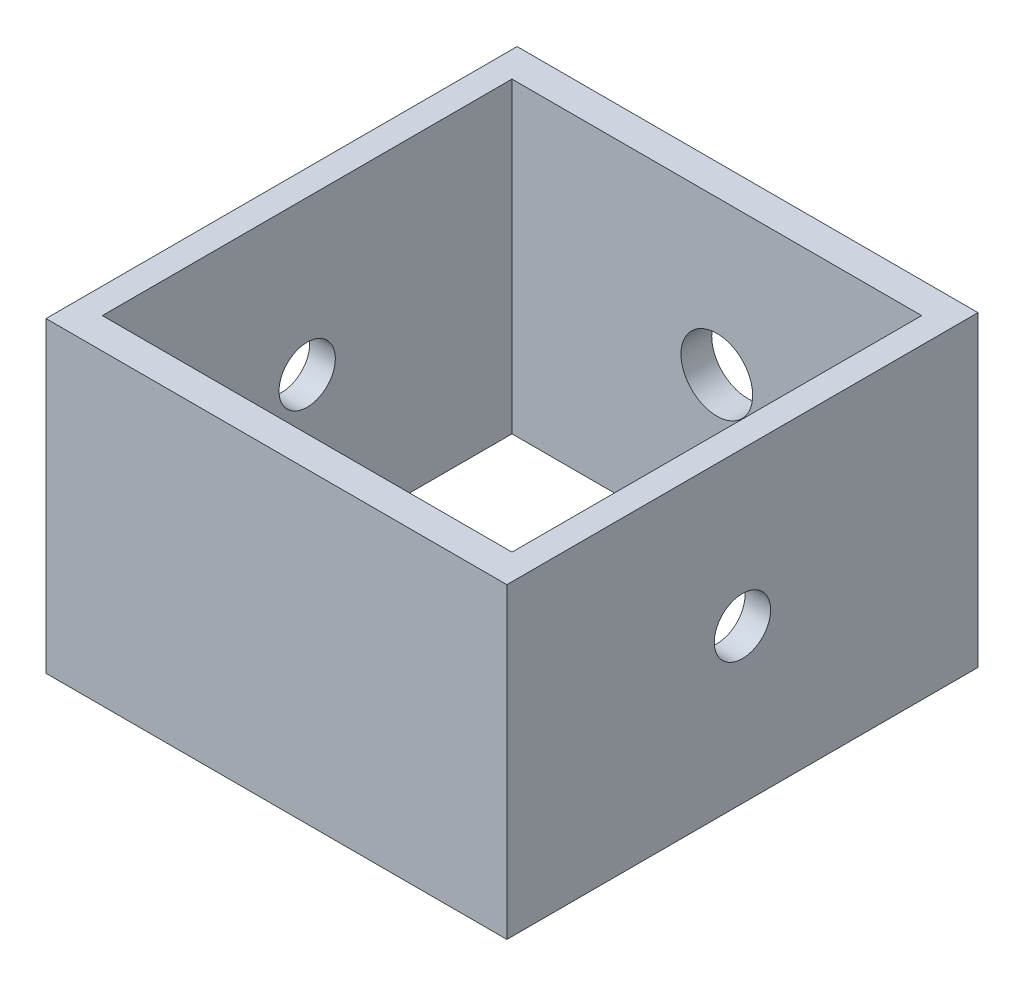
from build123d import *

# Parameters (mm, degrees)
SKETCH1_W           = 45
SKETCH1_H           = 46
BOSS_EXTRUDE1_DEPTH = 30
SKETCH3_R           = 3.5
CUT_EXTRUDE2_DEPTH  = 10
SKETCH4_R           = 2.75
CUT_EXTRUDE3_DEPTH  = 59.77074102
SKETCH2_W           = 40
SKETCH2_H           = 40
CUT_EXTRUDE4_DEPTH  = 44.991476447


with BuildPart() as part:
    # Sketch1 → Boss-Extrude1 (new body)
    with BuildSketch(Plane(origin=(0, 0, 0), x_dir=(1, 0, 0), z_dir=(0, 1, 0))):
        Rectangle(SKETCH1_W, SKETCH1_H)
    extrude(amount=BOSS_EXTRUDE1_DEPTH)

    # Sketch3 → Cut-Extrude2 (cut)
    with BuildSketch(Plane(origin=(0, 0, -23), x_dir=(-1, 0, 0), z_dir=(0, 0, -1))):
        with Locations((0, 15)):
            Circle(SKETCH3_R)
    extrude(amount=-CUT_EXTRUDE2_DEPTH, mode=Mode.SUBTRACT)

    # Sketch4 → Cut-Extrude3 (cut, through all)
    with BuildSketch(Plane(origin=(22.5, 0, 0), x_dir=(0, 0, -1), z_dir=(1, 0, 0))):
        with Locations((0, 15)):
            Circle(SKETCH4_R)
    extrude(amount=-CUT_EXTRUDE3_DEPTH, mode=Mode.SUBTRACT)

    # Sketch2 → Cut-Extrude4 (cut, through all)
    with BuildSketch(Plane(origin=(0, 30, 0), x_dir=(1, 0, 0), z_dir=(0, 1, 0))):
        Rectangle(SKETCH2_W, SKETCH2_H)
    extrude(amount=-CUT_EXTRUDE4_DEPTH, mode=Mode.SUBTRACT)


solid = part.part
